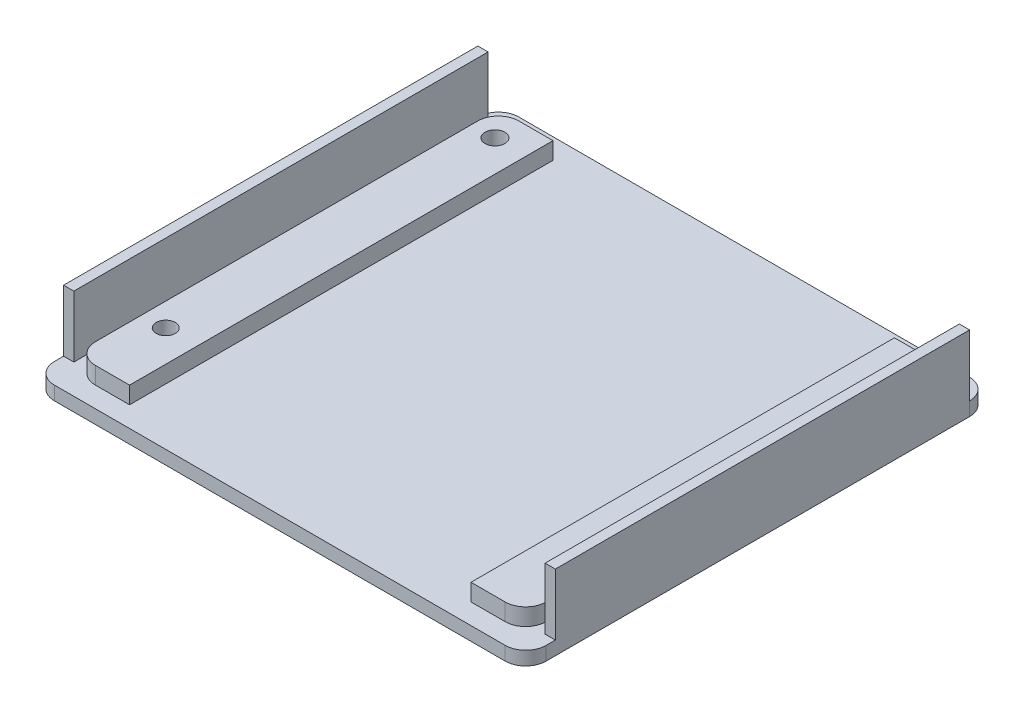
from build123d import *

# Parameters (mm, degrees)
EXTRUDE_1_DEPTH = 2
SKETCH_3_W      = 1.5
SKETCH_3_H      = 60.659832998
EXTRUDE_2_DEPTH = 9
SKETCH_4_R      = 1.45
SKETCH_4_R_2    = 1.4
EXTRUDE_3_DEPTH = 2.5


with BuildPart() as part:
    # 草图2 → 凸台-拉伸1 (new body)
    with BuildSketch(Plane(origin=(0, 0, 0), x_dir=(1, 0, 0), z_dir=(0, 1, 0))):
        with BuildLine():
            Line((-33, 34), (33, 34))
            ThreePointArc((33, 34), (35.121320344, 33.121320344), (36, 31))
            Line((36, 31), (36, -31))
            ThreePointArc((36, -31), (35.121320344, -33.121320344), (33, -34))
            Line((33, -34), (-33, -34))
            ThreePointArc((-33, -34), (-35.121320344, -33.121320344), (-36, -31))
            Line((-36, -31), (-36, 31))
            ThreePointArc((-36, 31), (-35.121320344, 33.121320344), (-33, 34))
        make_face()
    extrude(amount=EXTRUDE_1_DEPTH)

    # 草图3 → 凸台-拉伸2 (add)
    with BuildSketch(Plane(origin=(0, 2, 0), x_dir=(1, 0, 0), z_dir=(0, 1, 0))):
        with Locations((-35.25, 0.670083501)):
            Rectangle(SKETCH_3_W, SKETCH_3_H)
        with Locations((35.25, 0.670083501)):
            Rectangle(SKETCH_3_W, SKETCH_3_H)
    extrude(amount=EXTRUDE_2_DEPTH)

    # 草图4 → 凸台-拉伸3 (add)
    # profile 1 of 2: a face of its own
    with BuildSketch(Plane(origin=(0, 2, 0), x_dir=(1, 0, 0), z_dir=(0, 1, 0))):
        with BuildLine():
            Line((-30, 31), (-25, 31))
            Line((-25, 31), (-25, -31))
            Line((-25, -31), (-30, -31))
            ThreePointArc((-30, -31), (-32.121320344, -30.121320344), (-33, -28))
            Line((-33, -28), (-33, 28))
            ThreePointArc((-33, 28), (-32.121320344, 30.121320344), (-30, 31))
        make_face()
        with Locations(Location((-29.6, 27.1, 0), (0, 0, 270))):
            Circle(SKETCH_4_R, mode=Mode.SUBTRACT)
        with Locations(Location((-29.6, -21.1, 0), (0, 0, 270))):
            Circle(SKETCH_4_R_2, mode=Mode.SUBTRACT)
    # profile 2 of 2: a face of its own
    with BuildSketch(Plane(origin=(0, 2, 0), x_dir=(1, 0, 0), z_dir=(0, 1, 0))):
        with BuildLine():
            Line((30, -31), (25, -31))
            Line((25, -31), (25, 31))
            Line((25, 31), (30, 31))
            ThreePointArc((30, 31), (32.121320344, 30.121320344), (33, 28))
            Line((33, 28), (33, -28))
            ThreePointArc((33, -28), (32.121320344, -30.121320344), (30, -31))
        make_face()
        with Locations(Location((29.6, 27.1, 0), (0, 0, 90))):
            Circle(SKETCH_4_R, mode=Mode.SUBTRACT)
        with Locations(Location((29.6, -21.1, 0), (0, 0, 90))):
            Circle(SKETCH_4_R_2, mode=Mode.SUBTRACT)
    extrude(amount=EXTRUDE_3_DEPTH)


solid = part.part
